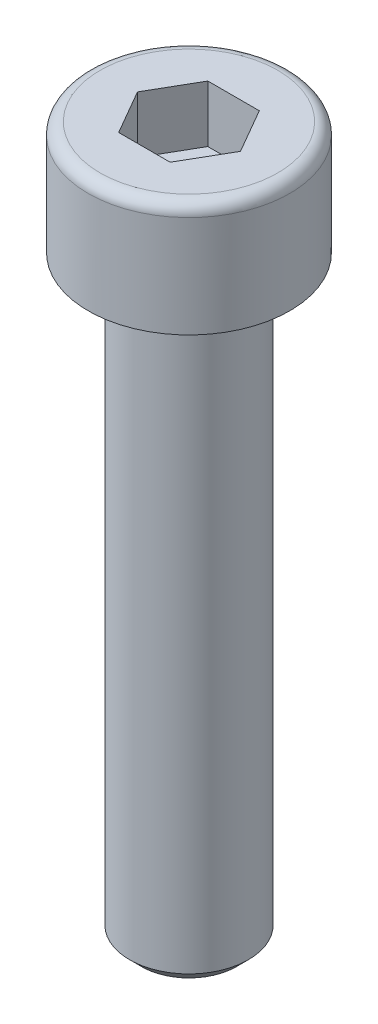
from build123d import *

# Parameters (mm, degrees)
CHAMFER1_SIZE      = 0.4
FILLET1_R          = 0.4
CUT_EXTRUDE1_DEPTH = 1.91


with BuildPart() as part:
    # Sketch1 → Revolve1 (revolve)
    with BuildSketch(Plane.XY, mode=Mode.PRIVATE) as revolve1_sk:
        Polygon((0, 0), (0, 3.82), (3.39, 3.82), (3.39, 0), (2, 0), (2, -20), (0, -20), align=None)
    revolve(revolve1_sk.sketch.rotate(Axis((0, 3.82, 0), (0, 1, 0)), 90), axis=Axis((0, 3.82, 0), (0, 1, 0)))

    # Chamfer1
    chamfer1_edges = [part.edges().sort_by_distance(p)[0] for p in [
        (0, -20, 2),
    ]]
    chamfer(chamfer1_edges, length=CHAMFER1_SIZE)

    # Fillet1
    fillet1_edges = [part.edges().sort_by_distance(p)[0] for p in [
        (0, 3.82, 3.39),
    ]]
    fillet(fillet1_edges, radius=FILLET1_R)

    # Sketch2 → Cut-Extrude1 (cut)
    with BuildSketch(Plane(origin=(0, 3.82, 0), x_dir=(1, 0, 0), z_dir=(0, 1, 0))):
        Polygon((0.866025404, -1.5), (1.732050808, 0), (0.866025404, 1.5), (-0.866025404, 1.5), (-1.732050808, 0), (-0.866025404, -1.5), align=None)
    extrude(amount=-CUT_EXTRUDE1_DEPTH, mode=Mode.SUBTRACT)


solid = part.part
